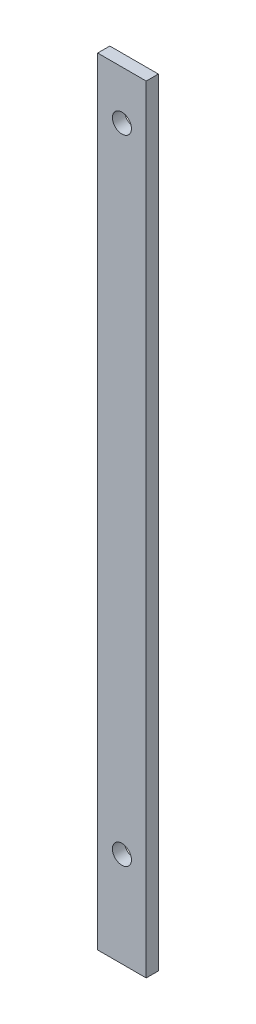
from build123d import *

# Parameters (mm, degrees)
SKETCH1_W              = 12.7
SKETCH1_H              = 203.2
BOSS_EXTRUDE1_DEPTH    = 3.175
F_10_CLEARANCE_HOLE1_D = 4.9784
F_10_CLEARANCE_HOLE2_D = 4.9784


with BuildPart() as part:
    # Sketch1 → Boss-Extrude1 (new body)
    with BuildSketch(Plane.XY):
        with Locations((-12.7, 0)):
            Rectangle(SKETCH1_W, SKETCH1_H)
    extrude(amount=BOSS_EXTRUDE1_DEPTH)

    # #10 Clearance Hole1 (through all)
    with Locations(Plane.XY.offset(3.175)):
        with Locations((-12.7, -76.754256991)):
            Hole(F_10_CLEARANCE_HOLE1_D / 2)

    # #10 Clearance Hole2 (through all)
    with Locations(Plane.XY.offset(3.175)):
        with Locations((-12.7, 88.9)):
            Hole(F_10_CLEARANCE_HOLE2_D / 2)


solid = part.part
